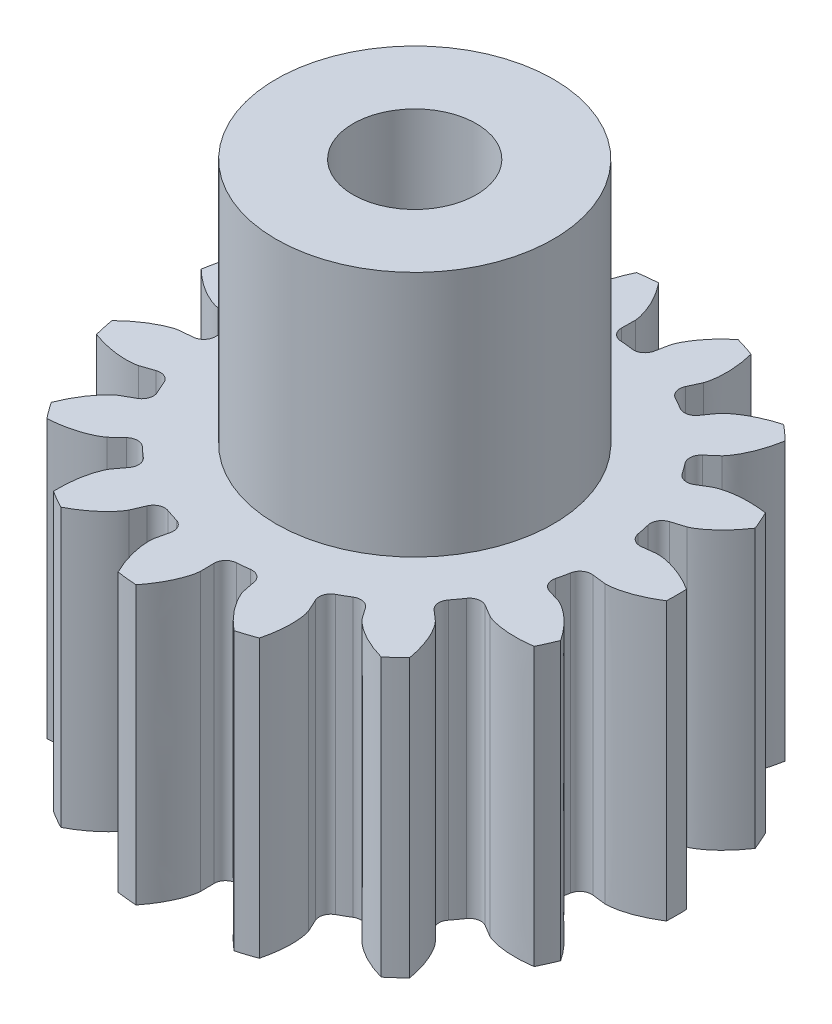
from build123d import *

# Parameters (mm, degrees)
BOSS_EXTRUDE1_DEPTH      = 4.5
BOSS_EXTRUDE1_DEPTH_BACK = 4.5
SKETCH2_R                = 4.5
BOSS_EXTRUDE2_DEPTH      = 8
CUT_EXTRUDE1_REACH       = 22.813
SKETCH3_R                = 2


with BuildPart() as part:
    # Sketch1 → Boss-Extrude1 (new, two sides: drawn at the far end of the back side and taken through both)
    with BuildSketch(Plane(origin=(0, 0, 9), x_dir=(1, 0, 0), z_dir=(0, -1, 0)).offset(-BOSS_EXTRUDE1_DEPTH_BACK)):
        with BuildLine():
            Line((6.567109026, -9.789353559), (7.013376588, -9.842263002))
            add(Edge.make_bspline(
                [(7.013376588, -9.842263002), (7.13650623, -9.846158953), (7.26014648, -9.826739675), (7.380662944, -9.801207947), (7.5493573, -9.765469607), (7.714728417, -9.712040157), (7.874555163, -9.647306658), (8.089914841, -9.560081048), (8.297207677, -9.451055972), (8.493631405, -9.3269358)],
                knots=[0, 0, 0, 0, 0.000369574, 0.000369574, 0.000369574, 0.000886684, 0.000886684, 0.000886684, 0.001584079, 0.001584079, 0.001584079, 0.001584079], degree=3))
            ThreePointArc((8.493631405, -9.3269358), (8.499921204, -9), (8.493631405, -8.6730642))
            add(Edge.make_bspline(
                [(8.493631405, -8.6730642), (8.306513905, -8.554824634), (8.109584884, -8.450333654), (7.905230151, -8.36528839), (7.765919668, -8.307312258), (7.622450842, -8.257991784), (7.476161462, -8.221004491), (7.40107364, -8.20201955), (7.325048593, -8.186231596), (7.248436403, -8.174865806), (7.170725894, -8.163337076), (7.091898317, -8.155252488), (7.013376588, -8.157736998)],
                knots=[0, 0, 0, 0, 0.000664035, 0.000664035, 0.000664035, 0.001116085, 0.001116085, 0.001116085, 0.001347695, 0.001347695, 0.001347695, 0.001582954, 0.001582954, 0.001582954, 0.001582954], degree=3))
            Line((7.013376588, -8.157736998), (6.567109026, -8.210646441))
            ThreePointArc((6.567109026, -8.210646441), (6.299401561, -8.139849418), (6.153266145, -7.90463899))
            ThreePointArc((6.153266145, -7.90463899), (6.113422505, -7.700551932), (6.066811797, -7.49790326))
            ThreePointArc((6.066811797, -7.49790326), (6.104644442, -7.223589213), (6.320411637, -7.050026478))
            Line((6.320411637, -7.050026478), (6.749617551, -6.91684829))
            add(Edge.make_bspline(
                [(6.749617551, -6.91684829), (6.863686702, -6.870326081), (6.968739159, -6.802296667), (7.068451738, -6.729953811), (7.208025608, -6.628691037), (7.337367925, -6.512618312), (7.457047437, -6.388473925), (7.618310441, -6.221194693), (7.763337377, -6.037281737), (7.892295159, -5.84399959)],
                knots=[0, 0, 0, 0, 0.000369574, 0.000369574, 0.000369574, 0.000886684, 0.000886684, 0.000886684, 0.001584079, 0.001584079, 0.001584079, 0.001584079], degree=3))
            ThreePointArc((7.892295159, -5.84399959), (7.765064406, -5.542770583), (7.626341619, -5.246658159))
            add(Edge.make_bspline(
                [(7.626341619, -5.246658159), (7.407308913, -5.214748485), (7.18490499, -5.199389474), (6.963626627, -5.204815317), (6.81277915, -5.208514164), (6.661653412, -5.221811698), (6.512967325, -5.247523375), (6.436649316, -5.260720737), (6.360775441, -5.277219896), (6.286163839, -5.297997716), (6.2104826, -5.319073408), (6.135181726, -5.343749833), (6.064459099, -5.37795721)],
                knots=[0, 0, 0, 0, 0.000664035, 0.000664035, 0.000664035, 0.001116085, 0.001116085, 0.001116085, 0.001347695, 0.001347695, 0.001347695, 0.001582954, 0.001582954, 0.001582954, 0.001582954], degree=3))
            Line((6.064459099, -5.37795721), (5.678293604, -5.607805762))
            ThreePointArc((5.678293604, -5.607805762), (5.404934922, -5.652015898), (5.175764877, -5.496579109))
            ThreePointArc((5.175764877, -5.496579109), (5.056356215, -5.326342173), (4.931350574, -5.160171681))
            ThreePointArc((4.931350574, -5.160171681), (4.854338841, -4.894185407), (4.980857657, -4.647867535))
            Line((4.980857657, -4.647867535), (5.318788321, -4.351629433))
            add(Edge.make_bspline(
                [(5.318788321, -4.351629433), (5.404073389, -4.262733177), (5.472373528, -4.157856531), (5.534041011, -4.051211284), (5.620360805, -3.90193333), (5.691309861, -3.743287359), (5.750148465, -3.581197774), (5.829430956, -3.362789019), (5.887115516, -3.135788405), (5.926309381, -2.906764522)],
                knots=[0, 0, 0, 0, 0.000369574, 0.000369574, 0.000369574, 0.000886684, 0.000886684, 0.000886684, 0.001584079, 0.001584079, 0.001584079, 0.001584079], degree=3))
            ThreePointArc((5.926309381, -2.906764522), (5.687557429, -2.68332754), (5.440388084, -2.469239021))
            add(Edge.make_bspline(
                [(5.440388084, -2.469239021), (5.227312916, -2.529176712), (5.01788975, -2.605605381), (4.817948796, -2.700564154), (4.681647225, -2.765298415), (4.548995588, -2.838914692), (4.42362197, -2.922879558), (4.35926985, -2.965977279), (4.296666428, -3.011910696), (4.236956439, -3.061239451), (4.176390443, -3.111275387), (4.117636479, -3.164446048), (4.066941537, -3.224461526)],
                knots=[0, 0, 0, 0, 0.000664035, 0.000664035, 0.000664035, 0.001116085, 0.001116085, 0.001116085, 0.001347695, 0.001347695, 0.001347695, 0.001582954, 0.001582954, 0.001582954, 0.001582954], degree=3))
            Line((4.066941537, -3.224461526), (3.807649632, -3.591506283))
            ThreePointArc((3.807649632, -3.591506283), (3.575905932, -3.743079246), (3.30332684, -3.694292527))
            ThreePointArc((3.30332684, -3.694292527), (3.125, -3.587341226), (2.943214036, -3.486381303))
            ThreePointArc((2.943214036, -3.486381303), (2.764673953, -3.274714244), (2.780068139, -2.998231832))
            Line((2.780068139, -2.998231832), (2.96829227, -2.590156076))
            add(Edge.make_bspline(
                [(2.96829227, -2.590156076), (3.010046692, -2.474256743), (3.029784799, -2.35066699), (3.042744319, -2.228159284), (3.06088456, -2.056677664), (3.061172619, -1.882889777), (3.048996584, -1.710881757), (3.0325899, -1.479108337), (2.992957899, -1.248270532), (2.935610871, -1.023105224)],
                knots=[0, 0, 0, 0, 0.000369574, 0.000369574, 0.000369574, 0.000886684, 0.000886684, 0.000886684, 0.001584079, 0.001584079, 0.001584079, 0.001584079], degree=3))
            ThreePointArc((2.935610871, -1.023105224), (2.626620103, -0.916094551), (2.313742025, -0.821047787))
            add(Edge.make_bspline(
                [(2.313742025, -0.821047787), (2.143467028, -0.96246907), (1.983235787, -1.117470209), (1.839203848, -1.285542678), (1.741015964, -1.400119211), (1.6497751, -1.521325308), (1.569392189, -1.649025074), (1.528133024, -1.714571167), (1.489624757, -1.781996537), (1.455140779, -1.851346838), (1.420162438, -1.92169135), (1.388114476, -1.994162555), (1.366212837, -2.069608913)],
                knots=[0, 0, 0, 0, 0.000664035, 0.000664035, 0.000664035, 0.001116085, 0.001116085, 0.001116085, 0.001347695, 0.001347695, 0.001347695, 0.001582954, 0.001582954, 0.001582954, 0.001582954], degree=3))
            Line((1.366212837, -2.069608913), (1.278628447, -2.510384503))
            ThreePointArc((1.278628447, -2.510384503), (1.128570321, -2.743111949), (0.859713583, -2.809410969))
            ThreePointArc((0.859713583, -2.809410969), (0.653302895, -2.784238154), (0.446169054, -2.765945687))
            ThreePointArc((0.446169054, -2.765945687), (0.196971823, -2.645197001), (0.098579583, -2.38635637))
            Line((0.098579583, -2.38635637), (0.10455152, -1.937002965))
            add(Edge.make_bspline(
                [(0.10455152, -1.937002965), (0.095555577, -1.814140602), (0.063318754, -1.693207534), (0.025329491, -1.576020064), (-0.027846432, -1.411985508), (-0.09826918, -1.253105209), (-0.179354506, -1.100920504), (-0.2886135, -0.895858148), (-0.418709328, -0.701097107), (-0.562681427, -0.5187235)],
                knots=[0, 0, 0, 0, 0.000369574, 0.000369574, 0.000369574, 0.000886684, 0.000886684, 0.000886684, 0.001584079, 0.001584079, 0.001584079, 0.001584079], degree=3))
            ThreePointArc((-0.562681427, -0.5187235), (-0.888483701, -0.546642254), (-1.21297105, -0.587071693))
            add(Edge.make_bspline(
                [(-1.21297105, -0.587071693), (-1.311003782, -0.785523545), (-1.394337662, -0.992296049), (-1.457556153, -1.204420956), (-1.500652775, -1.349028438), (-1.53470649, -1.49686672), (-1.556199759, -1.646220937), (-1.567231884, -1.722881886), (-1.574986569, -1.80014075), (-1.57828194, -1.8775213), (-1.581624555, -1.956011182), (-1.58142513, -2.035252003), (-1.570746474, -2.11308388)],
                knots=[0, 0, 0, 0, 0.000664035, 0.000664035, 0.000664035, 0.001116085, 0.001116085, 0.001116085, 0.001347695, 0.001347695, 0.001347695, 0.001582954, 0.001582954, 0.001582954, 0.001582954], degree=3))
            Line((-1.570746474, -2.11308388), (-1.471479212, -2.551376199))
            ThreePointArc((-1.471479212, -2.551376199), (-1.513905352, -2.825017438), (-1.732551962, -2.994938493))
            ThreePointArc((-1.732551962, -2.994938493), (-1.931356215, -3.055896773), (-2.128022611, -3.123434697))
            ThreePointArc((-2.128022611, -3.123434697), (-2.404788525, -3.114482928), (-2.599954278, -2.918039975))
            Line((-2.599954278, -2.918039975), (-2.777267138, -2.505106207))
            add(Edge.make_bspline(
                [(-2.777267138, -2.505106207), (-2.835457966, -2.396524834), (-2.914095679, -2.299158875), (-2.996465036, -2.20755442), (-3.111762524, -2.079329993), (-3.240719344, -1.962829129), (-3.376693572, -1.856781856), (-3.559913004, -1.713887709), (-3.757977909, -1.588879385), (-3.963680994, -1.480831533)],
                knots=[0, 0, 0, 0, 0.000369574, 0.000369574, 0.000369574, 0.000886684, 0.000886684, 0.000886684, 0.001584079, 0.001584079, 0.001584079, 0.001584079], degree=3))
            ThreePointArc((-3.963680994, -1.480831533), (-4.249960602, -1.638852307), (-4.529950411, -1.807767333))
            add(Edge.make_bspline(
                [(-4.529950411, -1.807767333), (-4.538790128, -2.028935625), (-4.530817461, -2.251726649), (-4.502291454, -2.471225671), (-4.482845015, -2.620860155), (-4.453823386, -2.76976804), (-4.412710631, -2.914952006), (-4.391608162, -2.989472438), (-4.367268408, -3.063206036), (-4.338805374, -3.135237034), (-4.309934294, -3.208300674), (-4.277521964, -3.280609652), (-4.236109451, -3.347369209)],
                knots=[0, 0, 0, 0, 0.000664035, 0.000664035, 0.000664035, 0.001116085, 0.001116085, 0.001116085, 0.001347695, 0.001347695, 0.001347695, 0.001582954, 0.001582954, 0.001582954, 0.001582954], degree=3))
            Line((-4.236109451, -3.347369209), (-3.967154748, -3.707393534))
            ThreePointArc((-3.967154748, -3.707393534), (-3.894613036, -3.974633511), (-4.025243534, -4.218795707))
            ThreePointArc((-4.025243534, -4.218795707), (-4.18206629, -4.355344841), (-4.334259835, -4.497035234))
            ThreePointArc((-4.334259835, -4.497035234), (-4.59073909, -4.601428225), (-4.848932425, -4.501349721))
            Line((-4.848932425, -4.501349721), (-5.178871077, -4.19623559))
            add(Edge.make_bspline(
                [(-5.178871077, -4.19623559), (-5.276195067, -4.120709912), (-5.387636496, -4.063746522), (-5.500143536, -4.013564324), (-5.657626606, -3.943321194), (-5.822819693, -3.889343824), (-5.990171643, -3.84777052), (-6.215671209, -3.791752278), (-6.447457969, -3.758111746), (-6.679324109, -3.743072103)],
                knots=[0, 0, 0, 0, 0.000369574, 0.000369574, 0.000369574, 0.000886684, 0.000886684, 0.000886684, 0.001584079, 0.001584079, 0.001584079, 0.001584079], degree=3))
            ThreePointArc((-6.679324109, -3.743072103), (-6.876580705, -4.003871671), (-7.063660193, -4.27206534))
            add(Edge.make_bspline(
                [(-7.063660193, -4.27206534), (-6.981778428, -4.477708065), (-6.883877761, -4.677995018), (-6.768539661, -4.86691478), (-6.689912627, -4.995703104), (-6.602833756, -5.119933065), (-6.506223747, -5.235843155), (-6.456635492, -5.295337809), (-6.404409863, -5.352796933), (-6.349109942, -5.407023566), (-6.293017238, -5.462027595), (-6.233996391, -5.514901852), (-6.169010619, -5.559045755)],
                knots=[0, 0, 0, 0, 0.000664035, 0.000664035, 0.000664035, 0.001116085, 0.001116085, 0.001116085, 0.001347695, 0.001347695, 0.001347695, 0.001582954, 0.001582954, 0.001582954, 0.001582954], degree=3))
            Line((-6.169010619, -5.559045755), (-5.776873187, -5.778550608))
            ThreePointArc((-5.776873187, -5.778550608), (-5.601906744, -5.993181103), (-5.62193393, -6.269366579))
            ThreePointArc((-5.62193393, -6.269366579), (-5.70965911, -6.457895981), (-5.791064157, -6.649239287))
            ThreePointArc((-5.791064157, -6.649239287), (-5.982909161, -6.848926542), (-6.259486104, -6.862516969))
            Line((-6.259486104, -6.862516969), (-6.685001158, -6.71797948))
            add(Edge.make_bspline(
                [(-6.685001158, -6.71797948), (-6.804630108, -6.688568573), (-6.929606017, -6.68185724), (-7.052797252, -6.681774257), (-7.225235649, -6.681658099), (-7.398101619, -6.6995374), (-7.567894618, -6.729626467), (-7.796683394, -6.770170193), (-8.022113973, -6.833714206), (-8.240051405, -6.914283265)],
                knots=[0, 0, 0, 0, 0.000369574, 0.000369574, 0.000369574, 0.000886684, 0.000886684, 0.000886684, 0.001584079, 0.001584079, 0.001584079, 0.001584079], degree=3))
            ThreePointArc((-8.240051405, -6.914283265), (-8.314177532, -7.232767011), (-8.375998955, -7.553866202))
            add(Edge.make_bspline(
                [(-8.375998955, -7.553866202), (-8.217553809, -7.708425865), (-8.046653057, -7.851577312), (-7.86444587, -7.977251872), (-7.74023357, -8.062925364), (-7.610154186, -8.140996913), (-7.47475167, -8.207591218), (-7.405251888, -8.241772929), (-7.334170672, -8.273022374), (-7.261595722, -8.300068364), (-7.187980332, -8.327502086), (-7.112556207, -8.351799182), (-7.035233808, -8.36569455)],
                knots=[0, 0, 0, 0, 0.000664035, 0.000664035, 0.000664035, 0.001116085, 0.001116085, 0.001116085, 0.001347695, 0.001347695, 0.001347695, 0.001582954, 0.001582954, 0.001582954, 0.001582954], degree=3))
            Line((-7.035233808, -8.36569455), (-6.587717771, -8.406725549))
            ThreePointArc((-6.587717771, -8.406725549), (-6.340579885, -8.531634999), (-6.246540877, -8.792088776))
            ThreePointArc((-6.246540877, -8.792088776), (-6.25, -9), (-6.246540877, -9.207911224))
            ThreePointArc((-6.246540877, -9.207911224), (-6.340579885, -9.468365001), (-6.587717771, -9.593274451))
            Line((-6.587717771, -9.593274451), (-7.035233808, -9.63430545))
            add(Edge.make_bspline(
                [(-7.035233808, -9.63430545), (-7.156482786, -9.656094727), (-7.273383704, -9.700795901), (-7.38595825, -9.750826481), (-7.54353581, -9.820857381), (-7.694184564, -9.907501859), (-7.837059861, -10.004050624), (-8.029578189, -10.134145939), (-8.209673592, -10.283887161), (-8.375998955, -10.446133798)],
                knots=[0, 0, 0, 0, 0.000369574, 0.000369574, 0.000369574, 0.000886684, 0.000886684, 0.000886684, 0.001584079, 0.001584079, 0.001584079, 0.001584079], degree=3))
            ThreePointArc((-8.375998955, -10.446133798), (-8.314177532, -10.767232989), (-8.240051405, -11.085716735))
            add(Edge.make_bspline(
                [(-8.240051405, -11.085716735), (-8.032439483, -11.162468567), (-7.818088938, -11.223732323), (-7.600517942, -11.264431406), (-7.452197811, -11.292176342), (-7.30160982, -11.310590199), (-7.150827123, -11.316353959), (-7.073432959, -11.319312397), (-6.995786742, -11.31894885), (-6.918485631, -11.3141377), (-6.840076326, -11.309257577), (-6.76129044, -11.300776323), (-6.685001158, -11.28202052)],
                knots=[0, 0, 0, 0, 0.000664035, 0.000664035, 0.000664035, 0.001116085, 0.001116085, 0.001116085, 0.001347695, 0.001347695, 0.001347695, 0.001582954, 0.001582954, 0.001582954, 0.001582954], degree=3))
            Line((-6.685001158, -11.28202052), (-6.259486104, -11.137483031))
            ThreePointArc((-6.259486104, -11.137483031), (-5.982909161, -11.151073458), (-5.791064157, -11.350760713))
            ThreePointArc((-5.791064157, -11.350760713), (-5.70965911, -11.542104019), (-5.62193393, -11.730633421))
            ThreePointArc((-5.62193393, -11.730633421), (-5.601906744, -12.006818897), (-5.776873187, -12.221449392))
            Line((-5.776873187, -12.221449392), (-6.169010619, -12.440954245))
            add(Edge.make_bspline(
                [(-6.169010619, -12.440954245), (-6.270914575, -12.510176142), (-6.359527273, -12.598560583), (-6.442019967, -12.690053985), (-6.557490098, -12.818122964), (-6.659873099, -12.958551002), (-6.751126257, -13.104865306), (-6.87408597, -13.302017549), (-6.977706065, -13.512064361), (-7.063660193, -13.72793466)],
                knots=[0, 0, 0, 0, 0.000369574, 0.000369574, 0.000369574, 0.000886684, 0.000886684, 0.000886684, 0.001584079, 0.001584079, 0.001584079, 0.001584079], degree=3))
            ThreePointArc((-7.063660193, -13.72793466), (-6.876580705, -13.996128329), (-6.679324109, -14.256927897))
            add(Edge.make_bspline(
                [(-6.679324109, -14.256927897), (-6.458443398, -14.242600808), (-6.237706217, -14.211383812), (-6.022391413, -14.160070178), (-5.875609349, -14.125089206), (-5.730550784, -14.080661448), (-5.590459603, -14.024598056), (-5.518553211, -13.995821682), (-5.44776773, -13.963908004), (-5.379106522, -13.928071605), (-5.309460983, -13.891721453), (-5.240936131, -13.851928335), (-5.178871077, -13.80376441)],
                knots=[0, 0, 0, 0, 0.000664035, 0.000664035, 0.000664035, 0.001116085, 0.001116085, 0.001116085, 0.001347695, 0.001347695, 0.001347695, 0.001582954, 0.001582954, 0.001582954, 0.001582954], degree=3))
            Line((-5.178871077, -13.80376441), (-4.848932425, -13.498650279))
            ThreePointArc((-4.848932425, -13.498650279), (-4.59073909, -13.398571775), (-4.334259835, -13.502964766))
            ThreePointArc((-4.334259835, -13.502964766), (-4.18206629, -13.644655159), (-4.025243534, -13.781204293))
            ThreePointArc((-4.025243534, -13.781204293), (-3.894613036, -14.025366489), (-3.967154748, -14.292606466))
            Line((-3.967154748, -14.292606466), (-4.236109451, -14.652630791))
            add(Edge.make_bspline(
                [(-4.236109451, -14.652630791), (-4.301048265, -14.757316213), (-4.346050801, -14.87410145), (-4.384197908, -14.991237633), (-4.437594776, -15.1552004), (-4.474009073, -15.325130714), (-4.497861591, -15.495911486), (-4.530001837, -15.726031242), (-4.539229769, -15.960064643), (-4.529950411, -16.192232667)],
                knots=[0, 0, 0, 0, 0.000369574, 0.000369574, 0.000369574, 0.000886684, 0.000886684, 0.000886684, 0.001584079, 0.001584079, 0.001584079, 0.001584079], degree=3))
            ThreePointArc((-4.529950411, -16.192232667), (-4.249960602, -16.361147693), (-3.963680994, -16.519168467))
            add(Edge.make_bspline(
                [(-3.963680994, -16.519168467), (-3.767723776, -16.416239741), (-3.578767423, -16.297939697), (-3.402938697, -16.163485939), (-3.283074653, -16.071827587), (-3.168627456, -15.972240176), (-3.06345083, -15.864043503), (-3.009465478, -15.808508013), (-2.957780186, -15.750562368), (-2.909631028, -15.689897159), (-2.860791601, -15.62836225), (-2.814376353, -15.56413786), (-2.777267138, -15.494893793)],
                knots=[0, 0, 0, 0, 0.000664035, 0.000664035, 0.000664035, 0.001116085, 0.001116085, 0.001116085, 0.001347695, 0.001347695, 0.001347695, 0.001582954, 0.001582954, 0.001582954, 0.001582954], degree=3))
            Line((-2.777267138, -15.494893793), (-2.599954278, -15.081960025))
            ThreePointArc((-2.599954278, -15.081960025), (-2.404788525, -14.885517072), (-2.128022611, -14.876565303))
            ThreePointArc((-2.128022611, -14.876565303), (-1.931356215, -14.944103227), (-1.732551962, -15.005061507))
            ThreePointArc((-1.732551962, -15.005061507), (-1.513905352, -15.174982562), (-1.471479212, -15.448623801))
            Line((-1.471479212, -15.448623801), (-1.570746474, -15.88691612))
            add(Edge.make_bspline(
                [(-1.570746474, -15.88691612), (-1.587491636, -16.008964007), (-1.581102663, -16.13395681), (-1.568308202, -16.256481865), (-1.550399002, -16.427987769), (-1.514548232, -16.598037864), (-1.466875795, -16.763755556), (-1.402639232, -16.98705303), (-1.315879408, -17.204606518), (-1.21297105, -17.412928307)],
                knots=[0, 0, 0, 0, 0.000369574, 0.000369574, 0.000369574, 0.000886684, 0.000886684, 0.000886684, 0.001584079, 0.001584079, 0.001584079, 0.001584079], degree=3))
            ThreePointArc((-1.21297105, -17.412928307), (-0.888483701, -17.453357746), (-0.562681427, -17.4812765))
            add(Edge.make_bspline(
                [(-0.562681427, -17.4812765), (-0.425530485, -17.307543449), (-0.30102723, -17.122615508), (-0.195086966, -16.928269903), (-0.122866523, -16.795782733), (-0.058819656, -16.658255237), (-0.006743578, -16.51663347), (0.019986176, -16.443941454), (0.043634423, -16.369983172), (0.062946104, -16.294978719), (0.082534638, -16.218898997), (0.098814664, -16.141348316), (0.10455152, -16.062997035)],
                knots=[0, 0, 0, 0, 0.000664035, 0.000664035, 0.000664035, 0.001116085, 0.001116085, 0.001116085, 0.001347695, 0.001347695, 0.001347695, 0.001582954, 0.001582954, 0.001582954, 0.001582954], degree=3))
            Line((0.10455152, -16.062997035), (0.098579583, -15.61364363))
            ThreePointArc((0.098579583, -15.61364363), (0.196971823, -15.354802999), (0.446169054, -15.234054313))
            ThreePointArc((0.446169054, -15.234054313), (0.653302895, -15.215761846), (0.859713583, -15.190589031))
            ThreePointArc((0.859713583, -15.190589031), (1.128570321, -15.256888051), (1.278628447, -15.489615497))
            Line((1.278628447, -15.489615497), (1.366212837, -15.930391087))
            add(Edge.make_bspline(
                [(1.366212837, -15.930391087), (1.400556719, -16.048698251), (1.457232489, -16.160286229), (1.51875624, -16.267014459), (1.604874844, -16.416408571), (1.706791757, -16.557175242), (1.817746153, -16.689175759), (1.967252438, -16.867040788), (2.134998457, -17.030497389), (2.313742025, -17.178952213)],
                knots=[0, 0, 0, 0, 0.000369574, 0.000369574, 0.000369574, 0.000886684, 0.000886684, 0.000886684, 0.001584079, 0.001584079, 0.001584079, 0.001584079], degree=3))
            ThreePointArc((2.313742025, -17.178952213), (2.626620103, -17.083905449), (2.935610871, -16.976894776))
            add(Edge.make_bspline(
                [(2.935610871, -16.976894776), (2.990240893, -16.762397423), (3.028763307, -16.542817307), (3.046497074, -16.322183974), (3.058586345, -16.171776221), (3.061158598, -16.020088395), (3.051129699, -15.869529224), (3.045982039, -15.792249792), (3.037504244, -15.715066931), (3.024639283, -15.638692185), (3.011589889, -15.561222526), (2.994919729, -15.48375477), (2.96829227, -15.409843924)],
                knots=[0, 0, 0, 0, 0.000664035, 0.000664035, 0.000664035, 0.001116085, 0.001116085, 0.001116085, 0.001347695, 0.001347695, 0.001347695, 0.001582954, 0.001582954, 0.001582954, 0.001582954], degree=3))
            Line((2.96829227, -15.409843924), (2.780068139, -15.001768168))
            ThreePointArc((2.780068139, -15.001768168), (2.764673953, -14.725285756), (2.943214036, -14.513618697))
            ThreePointArc((2.943214036, -14.513618697), (3.125, -14.412658774), (3.30332684, -14.305707473))
            ThreePointArc((3.30332684, -14.305707473), (3.575905932, -14.256920754), (3.807649632, -14.408493717))
            Line((3.807649632, -14.408493717), (4.066941537, -14.775538474))
            add(Edge.make_bspline(
                [(4.066941537, -14.775538474), (4.146436093, -14.869648531), (4.243598905, -14.948537109), (4.343213931, -15.021014235), (4.48265125, -15.122464955), (4.633011946, -15.209608365), (4.788063278, -15.285067619), (4.99698829, -15.386745724), (5.216715693, -15.467842307), (5.440388084, -15.530760979)],
                knots=[0, 0, 0, 0, 0.000369574, 0.000369574, 0.000369574, 0.000886684, 0.000886684, 0.000886684, 0.001584079, 0.001584079, 0.001584079, 0.001584079], degree=3))
            ThreePointArc((5.440388084, -15.530760979), (5.687557429, -15.31667246), (5.926309381, -15.093235478))
            add(Edge.make_bspline(
                [(5.926309381, -15.093235478), (5.888972455, -14.875062364), (5.834853152, -14.658797468), (5.761314093, -14.450025917), (5.711181847, -14.307704447), (5.65183472, -14.168084493), (5.581434934, -14.034620967), (5.545299935, -13.966116436), (5.506161986, -13.899054613), (5.463344851, -13.834515462), (5.419913888, -13.769051074), (5.373175964, -13.705061122), (5.318788321, -13.648370567)],
                knots=[0, 0, 0, 0, 0.000664035, 0.000664035, 0.000664035, 0.001116085, 0.001116085, 0.001116085, 0.001347695, 0.001347695, 0.001347695, 0.001582954, 0.001582954, 0.001582954, 0.001582954], degree=3))
            Line((5.318788321, -13.648370567), (4.980857657, -13.352132465))
            ThreePointArc((4.980857657, -13.352132465), (4.854338841, -13.105814593), (4.931350574, -12.839828319))
            ThreePointArc((4.931350574, -12.839828319), (5.056356215, -12.673657827), (5.175764877, -12.503420891))
            ThreePointArc((5.175764877, -12.503420891), (5.404934922, -12.347984102), (5.678293604, -12.392194238))
            Line((5.678293604, -12.392194238), (6.064459099, -12.62204279))
            add(Edge.make_bspline(
                [(6.064459099, -12.62204279), (6.175358998, -12.675683256), (6.296208519, -12.708231882), (6.416690476, -12.73392595), (6.585336531, -12.769891528), (6.758142279, -12.788343789), (6.930480763, -12.79421419), (7.16269947, -12.802124303), (7.396415393, -12.786838532), (7.626341619, -12.753341841)],
                knots=[0, 0, 0, 0, 0.000369574, 0.000369574, 0.000369574, 0.000886684, 0.000886684, 0.000886684, 0.001584079, 0.001584079, 0.001584079, 0.001584079], degree=3))
            ThreePointArc((7.626341619, -12.753341841), (7.765064406, -12.457229417), (7.892295159, -12.15600041))
            add(Edge.make_bspline(
                [(7.892295159, -12.15600041), (7.76944718, -11.971875648), (7.632043879, -11.796320139), (7.479947566, -11.635508866), (7.376262124, -11.525882356), (7.265257274, -11.422471832), (7.146659362, -11.329181007), (7.085785095, -11.281296432), (7.022754299, -11.235951246), (6.957388463, -11.194407095), (6.891085538, -11.152267365), (6.822361261, -11.112819662), (6.749617551, -11.08315171)],
                knots=[0, 0, 0, 0, 0.000664035, 0.000664035, 0.000664035, 0.001116085, 0.001116085, 0.001116085, 0.001347695, 0.001347695, 0.001347695, 0.001582954, 0.001582954, 0.001582954, 0.001582954], degree=3))
            Line((6.749617551, -11.08315171), (6.320411637, -10.949973522))
            ThreePointArc((6.320411637, -10.949973522), (6.104644442, -10.776410787), (6.066811797, -10.50209674))
            ThreePointArc((6.066811797, -10.50209674), (6.113422505, -10.299448068), (6.153266145, -10.09536101))
            ThreePointArc((6.153266145, -10.09536101), (6.299401561, -9.860150582), (6.567109026, -9.789353559))
        make_face()
    extrude(amount=BOSS_EXTRUDE1_DEPTH + BOSS_EXTRUDE1_DEPTH_BACK)

    # Sketch2 → Boss-Extrude2 (add)
    with BuildSketch(Plane(origin=(0, 4.5, 0), x_dir=(1, 0, 0), z_dir=(0, 1, 0))):
        Circle(SKETCH2_R)
    extrude(amount=BOSS_EXTRUDE2_DEPTH)

    # Sketch3 → Cut-Extrude1 (cut, up to next)
    with BuildSketch(Plane(origin=(0, 12.5, 0), x_dir=(1, 0, 0), z_dir=(0, 1, 0)), mode=Mode.PRIVATE) as cut_extrude1_sk1:
        Circle(SKETCH3_R)
    cut_extrude1_tool1 = extrude(cut_extrude1_sk1.sketch, amount=-CUT_EXTRUDE1_REACH, mode=Mode.PRIVATE) & part.part
    add(cut_extrude1_tool1.solids().sort_by_distance((0, 12.5, 0))[0], mode=Mode.SUBTRACT)


solid = part.part
